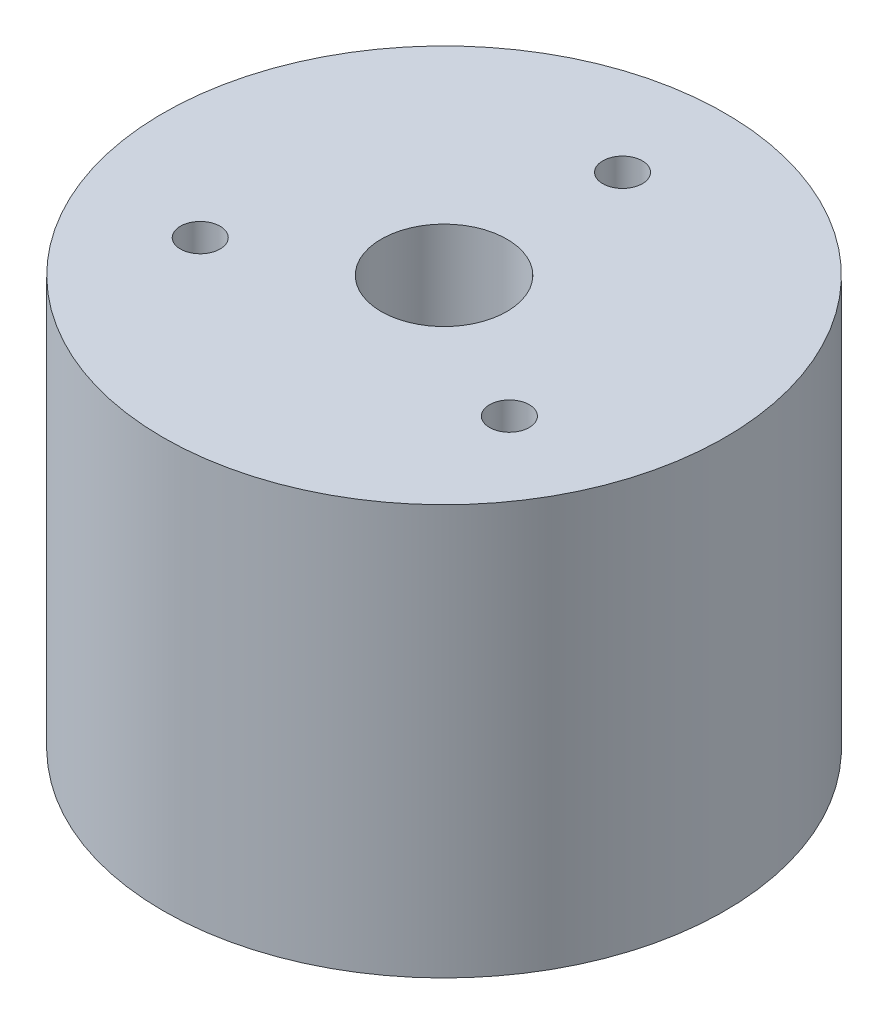
from build123d import *

# Parameters (mm, degrees)
SKETCH_1_R          = 21.25
SKETCH_1_R_2        = 1.5
SKETCH_1_R_3        = 4.75
EXTRUDE_1_DEPTH     = 31
SKETCH_1_3_R        = 1.5
CUT_EXTRUDE_1_DEPTH = 5


with BuildPart() as part:
    # 草图1 → 凸台-拉伸1 (new body)
    with BuildSketch(Plane(origin=(0, 0, 0), x_dir=(1, 0, 0), z_dir=(0, 1, 0))):
        Circle(SKETCH_1_R)
        with Locations((-11.691342951, -6.75)):
            Circle(SKETCH_1_R_2, mode=Mode.SUBTRACT)
        with Locations((11.691342951, -6.75)):
            Circle(SKETCH_1_R_2, mode=Mode.SUBTRACT)
        Circle(SKETCH_1_R_3, mode=Mode.SUBTRACT)
        with Locations((0, 13.5)):
            Circle(SKETCH_1_R_2, mode=Mode.SUBTRACT)
    extrude(amount=EXTRUDE_1_DEPTH)

    # 草图1<3> → 切除-拉伸1 (cut)
    with BuildSketch(Plane(origin=(0, 0, 0), x_dir=(1, 0, 0), z_dir=(0, 1, 0))):
        with Locations((10.522208656, 6.075)):
            Circle(SKETCH_1_3_R)
        with Locations((0, -12.15)):
            Circle(SKETCH_1_3_R)
        with Locations((-10.522208656, 6.075)):
            Circle(SKETCH_1_3_R)
    extrude(amount=CUT_EXTRUDE_1_DEPTH, mode=Mode.SUBTRACT)


solid = part.part
